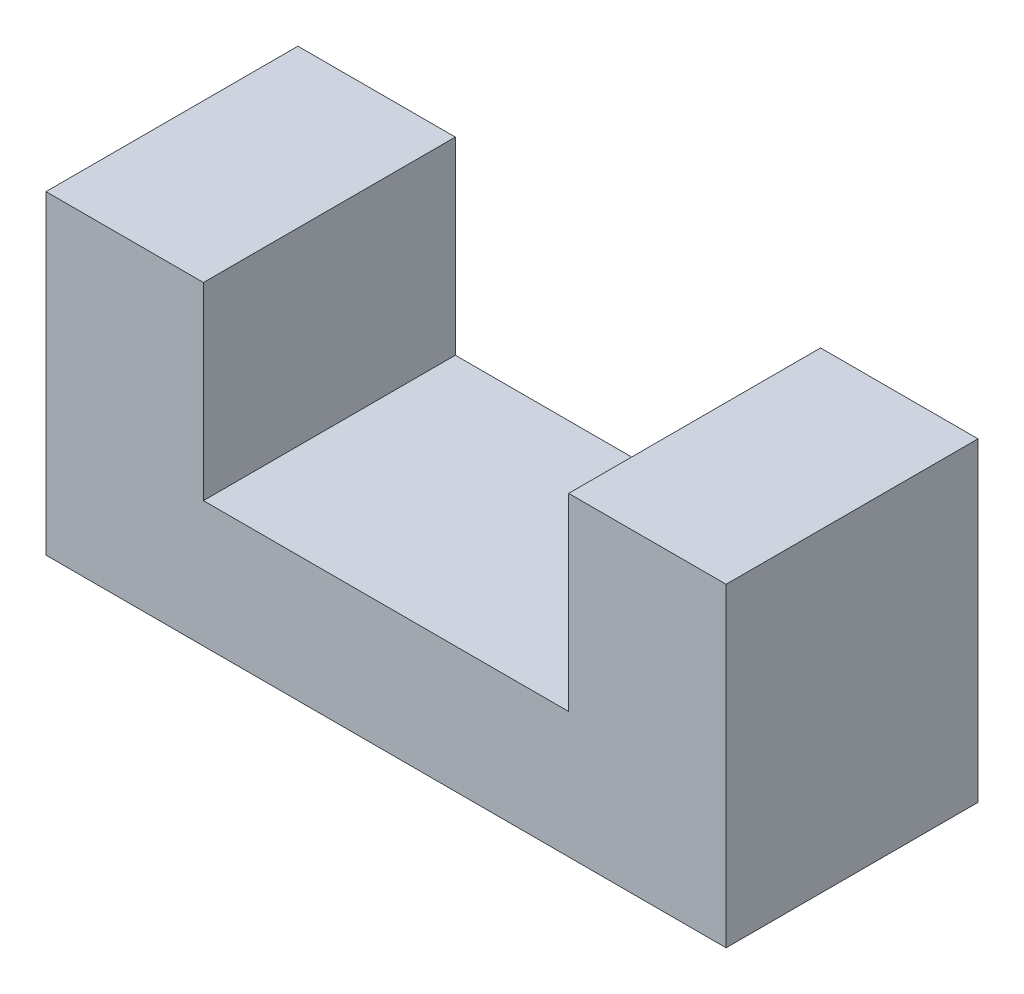
from build123d import *

# Parameters (mm, degrees)
BOSS_EXTRU_1_DEPTH = 4


with BuildPart() as part:
    # Esquisse1 → Boss.-Extru.1 (new body)
    with BuildSketch(Plane.XY):
        Polygon((-2.9, 0), (-2.9, 3), (-5.4, 3), (-5.4, -2), (0, -2), (0, 0), align=None)
        Polygon((2.9, 0), (0, 0), (0, -2), (5.4, -2), (5.4, 3), (2.9, 3), align=None)
    extrude(amount=BOSS_EXTRU_1_DEPTH)


solid = part.part
